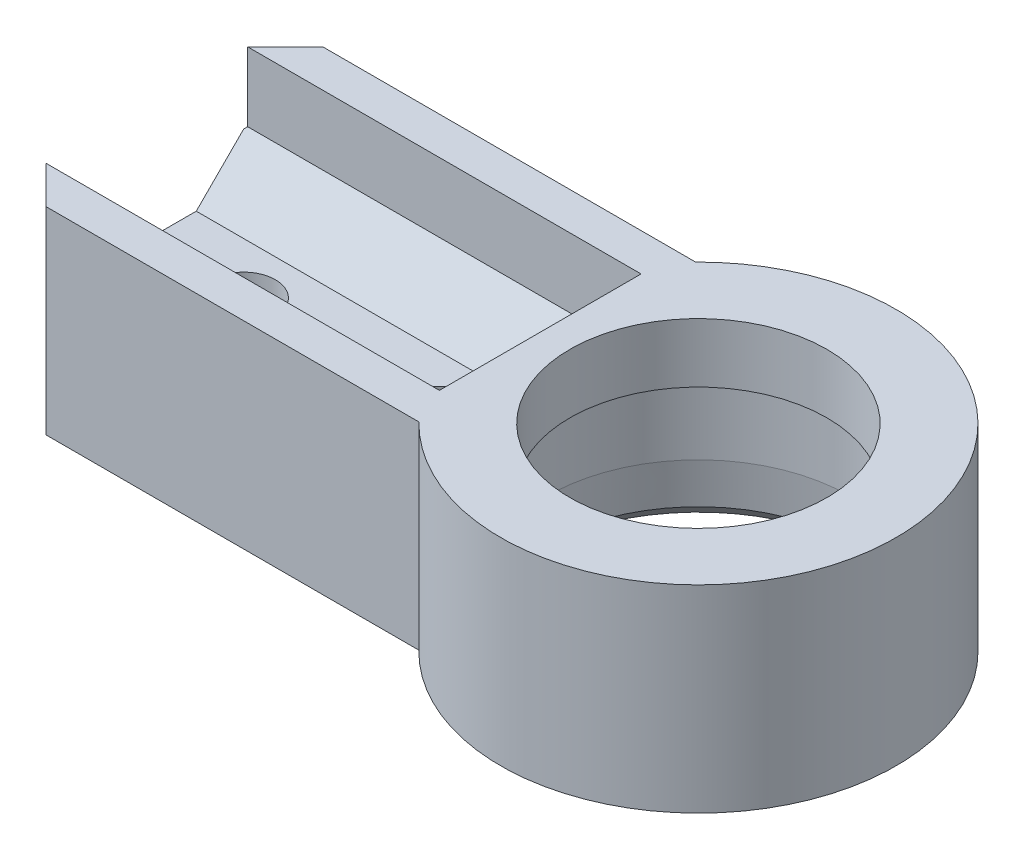
from build123d import *

# Parameters (mm, degrees)
BOSS_EXTRU_1_DEPTH      = 10
ESQUISSE2_W             = 10.2
ESQUISSE2_H             = 6
ENL_V_MAT_EXTRU_1_DEPTH = 20
CHANFREIN1_SIZE         = 2.5
CHANFREIN2_SIZE         = 1.8
ESQUISSE3_R             = 6.5
ENL_V_MAT_EXTRU_2_DEPTH = 32.368774283
ESQUISSE4_R             = 7.65
ENL_V_MAT_EXTRU_3_DEPTH = 7
CHANFREIN3_SIZE         = 1
ESQUISSE5_R             = 1.6
ENL_V_MAT_EXTRU_4_DEPTH = 7
CHANFREIN4_SIZE         = 2.1
CHANFREIN5_SIZE         = 2
CHANFREIN6_SIZE         = 2
CHANFREIN6_SIZE2        = 0.271180531


with BuildPart() as part:
    # Esquisse1 → Boss.-Extru.1 (new body)
    with BuildSketch(Plane(origin=(0, 0, 0), x_dir=(1, 0, 0), z_dir=(0, 1, 0))):
        with BuildLine():
            Line((-28, -7), (-7.141428429, -7))
            ThreePointArc((-7.141428429, -7), (10, 0), (-7.141428429, 7))
            Line((-7.141428429, 7), (-28, 7))
            Line((-28, 7), (-28, -7))
        make_face()
    extrude(amount=BOSS_EXTRU_1_DEPTH)

    # Esquisse2 → Enlèv. mat.-Extru.1 (cut)
    with BuildSketch(Plane.ZY.offset(28)):
        with Locations((0, 7)):
            Rectangle(ESQUISSE2_W, ESQUISSE2_H)
    extrude(amount=-ENL_V_MAT_EXTRU_1_DEPTH, mode=Mode.SUBTRACT)

    # Chanfrein1
    chanfrein1_edges = [part.edges().sort_by_distance(p)[0] for p in [
        (-18, 4, -5.1),
        (-18, 4, 5.1),
    ]]
    chamfer(chanfrein1_edges, length=CHANFREIN1_SIZE)

    # Chanfrein2
    chanfrein2_edges = [part.edges().sort_by_distance(p)[0] for p in [
        (-8, 4, 0),
        (-8, 5.25, -3.85),
        (-8, 5.25, 3.85),
    ]]
    chamfer(chanfrein2_edges, length=CHANFREIN2_SIZE)

    # Esquisse3 → Enlèv. mat.-Extru.2 (cut, through all)
    with BuildSketch(Plane.XZ):
        with Locations(Location((0, 0, 0), (0, 0, 270))):
            Circle(ESQUISSE3_R)
    extrude(amount=-ENL_V_MAT_EXTRU_2_DEPTH, mode=Mode.SUBTRACT)

    # Esquisse4 → Enlèv. mat.-Extru.3 (cut)
    with BuildSketch(Plane.XZ):
        with Locations(Location((0, 0, 0), (0, 0, 270))):
            Circle(ESQUISSE4_R)
    extrude(amount=-ENL_V_MAT_EXTRU_3_DEPTH, mode=Mode.SUBTRACT)

    # Chanfrein3
    chanfrein3_edges = [part.edges().sort_by_distance(p)[0] for p in [
        (0, 0, 7.65),
    ]]
    chamfer(chanfrein3_edges, length=CHANFREIN3_SIZE)

    # Esquisse5 → Enlèv. mat.-Extru.4 (cut)
    with BuildSketch(Plane.XZ):
        with Locations(Location((-23, 0, 0), (0, 0, 270))):
            Circle(ESQUISSE5_R)
        with Locations(Location((-13, 0, 0), (0, 0, 270))):
            Circle(ESQUISSE5_R)
    extrude(amount=-ENL_V_MAT_EXTRU_4_DEPTH, mode=Mode.SUBTRACT)

    # Chanfrein4
    chanfrein4_edges = [part.edges().sort_by_distance(p)[0] for p in [
        (-23, 0, 1.6),
        (-13, 0, 1.6),
    ]]
    chamfer(chanfrein4_edges, length=CHANFREIN4_SIZE)

    # Chanfrein5
    chanfrein5_edges = [part.edges().sort_by_distance(p)[0] for p in [
        (-28, 5, -7),
        (-28, 5, 7),
    ]]
    chamfer(chanfrein5_edges, length=CHANFREIN5_SIZE)

    # Chanfrein6
    chanfrein6_edges = [part.edges().sort_by_distance(p)[0] for p in [
        (0, 1, 7.65),
    ]]
    chanfrein6_side = [part.faces().sort_by_distance(p)[0] for p in [
        (0, 4, 7.65),
    ]]
    chamfer(chanfrein6_edges, length=CHANFREIN6_SIZE, length2=CHANFREIN6_SIZE2, reference=chanfrein6_side[0])


solid = part.part
